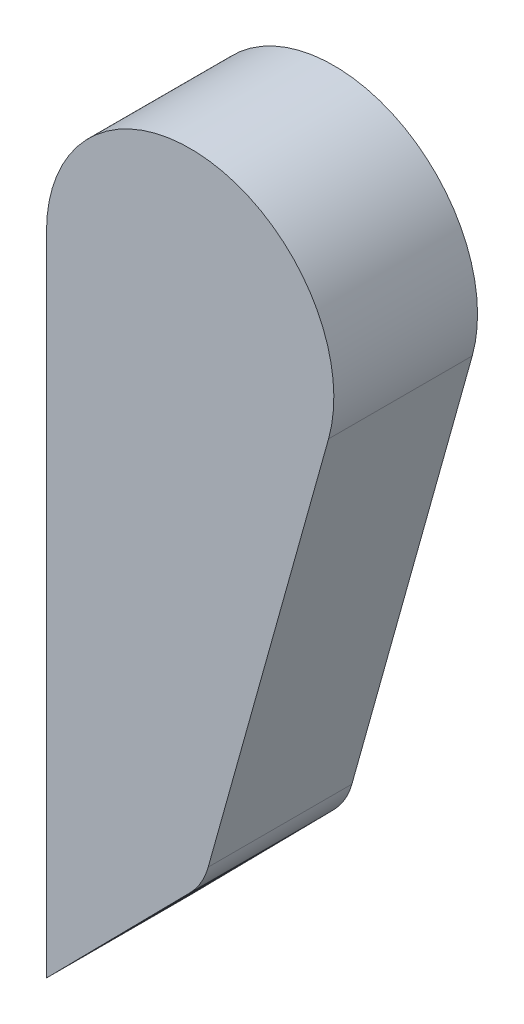
from build123d import *

# Parameters (mm, degrees)
BOSS_EXTRUDE1_DEPTH = 20


with BuildPart() as part:
    # Sketch1 → Boss-Extrude1 (new body)
    with BuildSketch(Plane.XY):
        with BuildLine():
            Line((-20, 0), (-20, -90))
            Line((-20, -90), (0, -69.709229677))
            ThreePointArc((0, -69.709229677), (1.530145443, -67.703543845), (2.509663453, -65.378750262))
            Line((2.509663453, -65.378750262), (19.263152536, -5.378750262))
            ThreePointArc((19.263152536, -5.378750262), (2.714493441, 19.814931879), (-20, 0))
        make_face()
    extrude(amount=BOSS_EXTRUDE1_DEPTH)


solid = part.part
